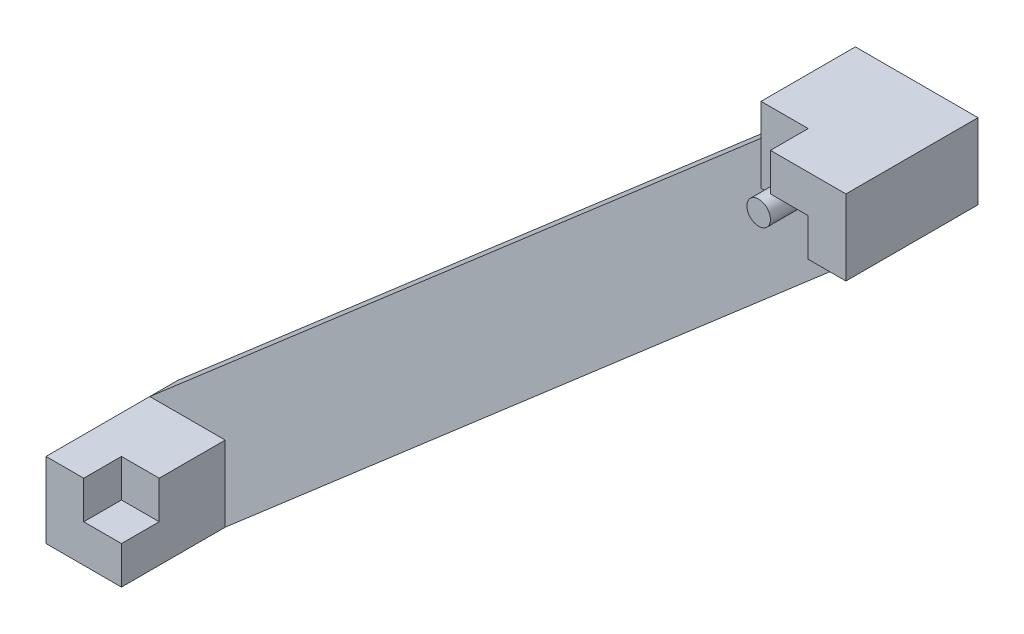
from build123d import *

# Parameters (mm, degrees)
BOSS_EXTRUDE1_DEPTH   = 4
BOSS_EXTRUDE1_2_DEPTH = 4
SKETCH2_W             = 13
SKETCH2_H             = 8
SKETCH2_W_2           = 8
BOSS_EXTRUDE2_DEPTH   = 7
BOSS_EXTRUDE3_DEPTH   = 3
SKETCH4_R             = 1.25
BOSS_EXTRUDE4_DEPTH   = 4


with BuildPart() as part:
    # Sketch1 → Boss-Extrude1 (new body)
    with BuildSketch(Plane.XY):
        Polygon((0, 0), (0, 4), (-4, 4), (-4, -4), (4, -4), (4, 0), align=None)
    extrude(amount=BOSS_EXTRUDE1_DEPTH)



with BuildPart() as body_2:
    # Sketch1 → Boss-Extrude1 2 (new body)
    with BuildSketch(Plane.XY):
        Polygon((76.8, 66.5), (76.8, 62.5), (80.8, 62.5), (80.8, 70.5), (72.8, 70.5), (72.8, 66.5), align=None)
    extrude(amount=BOSS_EXTRUDE1_2_DEPTH)


with BuildPart() as part_1:
    add(part.part)

    add(body_2.part)  # Boss-Extrude2 merges body 2
    # Sketch2 → Boss-Extrude2 (add)
    with BuildSketch(Plane(origin=(0, 0, 0), x_dir=(-1, 0, 0), z_dir=(0, 0, -1))):
        with Locations((-74.3, 66.5)):
            Rectangle(SKETCH2_W, SKETCH2_H)
        Rectangle(SKETCH2_W_2, SKETCH2_H)
    extrude(amount=BOSS_EXTRUDE2_DEPTH)

    # Sketch3 → Boss-Extrude3 (add)
    with BuildSketch(Plane(origin=(0, 0, -7), x_dir=(-1, 0, 0), z_dir=(0, 0, -1))):
        Polygon((4, 4), (4, -4), (-4, -4), (-80.8, 62.5), (-80.8, 70.5), (-67.8, 70.5), (-67.8, 66.170572917), align=None)
    extrude(amount=BOSS_EXTRUDE3_DEPTH)


with BuildPart() as body_2_2:
    # Sketch4 → Boss-Extrude4 (new body)
    with BuildSketch(Plane.XY):
        with Locations((71.55, 64.15)):
            Circle(SKETCH4_R)
    extrude(amount=BOSS_EXTRUDE4_DEPTH)


solid = Compound([part_1.part, body_2_2.part])
